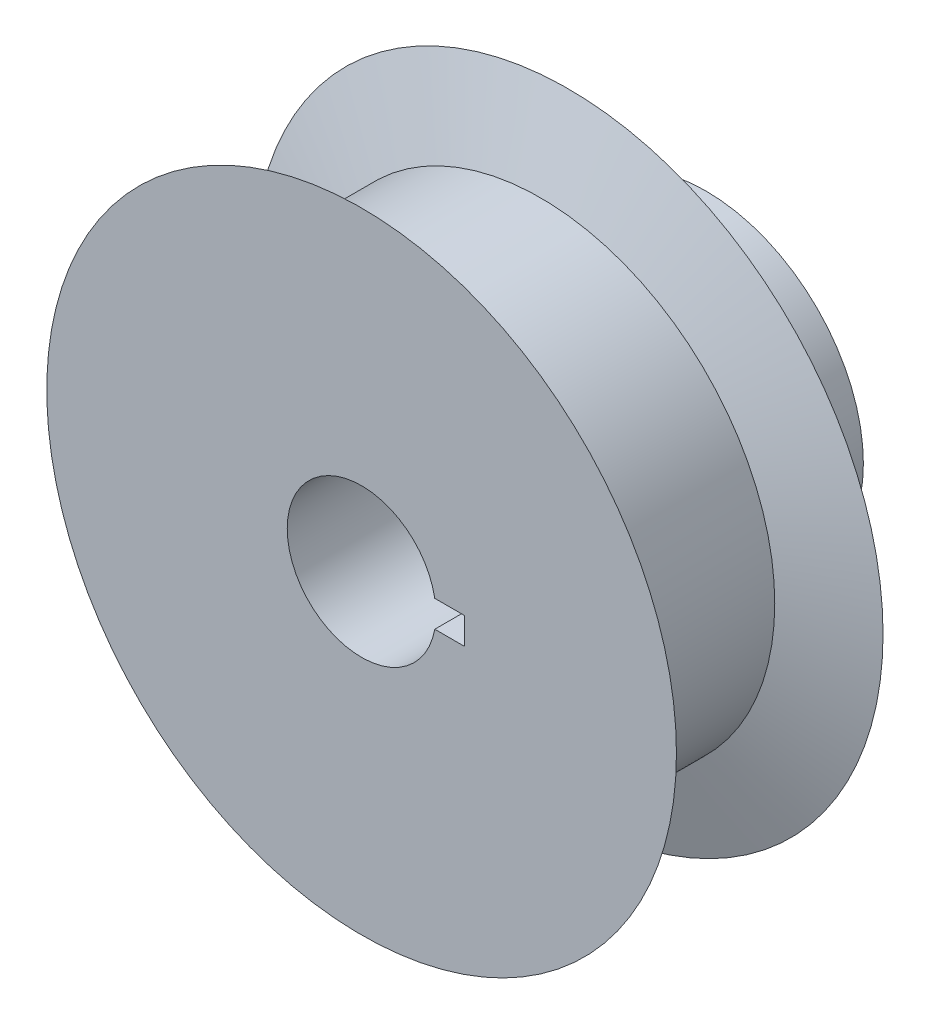
from build123d import *

# Parameters (mm, degrees)
SKETCH1_R               = 25.4
BOSS_EXTRUDE1_DEPTH     = 16.66748
SKETCH2_R               = 12.7
BOSS_EXTRUDE2_DEPTH     = 11.1125
CUT_EXTRUDE1_DEPTH      = 46.409770852
CUT_EXTRUDE2_DEPTH      = 11.1125
CUT_EXTRUDE2_DEPTH_BACK = 11.1125
SKETCH5_R               = 3.2639


with BuildPart() as part:
    # Sketch1 → Boss-Extrude1 (new body)
    with BuildSketch(Plane.XY):
        Circle(SKETCH1_R)
    extrude(amount=BOSS_EXTRUDE1_DEPTH)

    # Sketch2 → Boss-Extrude2 (add)
    with BuildSketch(Plane(origin=(0, 0, 0), x_dir=(-1, 0, 0), z_dir=(0, 0, -1))):
        with Locations(Location((0, 0, 0), (0, 0, 180))):
            Circle(SKETCH2_R)
    extrude(amount=BOSS_EXTRUDE2_DEPTH)

    # Sketch3 → Cut-Extrude1 (cut, through all)
    with BuildSketch(Plane(origin=(0, 0, -11.1125), x_dir=(-1, 0, 0), z_dir=(0, 0, -1))):
        with BuildLine():
            Line((-5.902263385, -1.078557803), (-8.315263385, -1.078557803))
            Line((-8.315263385, -1.078557803), (-8.315263385, 1.078557803))
            Line((-8.315263385, 1.078557803), (-5.902263385, 1.078557803))
            ThreePointArc((-5.902263385, 1.078557803), (6, 0), (-5.902263385, -1.078557803))
        make_face()
    extrude(amount=-CUT_EXTRUDE1_DEPTH, mode=Mode.SUBTRACT)

    # Sketch5 → Cut-Extrude2 (cut, two sides: drawn at the far end of the back side and taken through both)
    with BuildSketch(Plane(origin=(0, -9.525, 0), x_dir=(1, 0, 0), z_dir=(0, 1, 0)).offset(-CUT_EXTRUDE2_DEPTH_BACK)):
        with Locations(Location((0.599890424, 5.55752, 0), (0, 0, 90))):
            Circle(SKETCH5_R)
    extrude(amount=CUT_EXTRUDE2_DEPTH + CUT_EXTRUDE2_DEPTH_BACK, mode=Mode.SUBTRACT)

    # Sketch7 → Cut-Revolve1 (revolve, cut)
    with BuildSketch(Plane(origin=(0, 0, 0), x_dir=(0, 0, -1), z_dir=(1, 0, 0)), mode=Mode.PRIVATE) as cut_revolve1_sk:
        Polygon((-16.66748, 25.4), (0, 25.4), (-2.23774, 18.901131151), (-14.42974, 18.901131151), align=None)
    revolve(cut_revolve1_sk.sketch.rotate(Axis((0, 0, 16.66748), (0, 0, -1)), 90), axis=Axis((0, 0, 16.66748), (0, 0, -1)), mode=Mode.SUBTRACT)


solid = part.part
